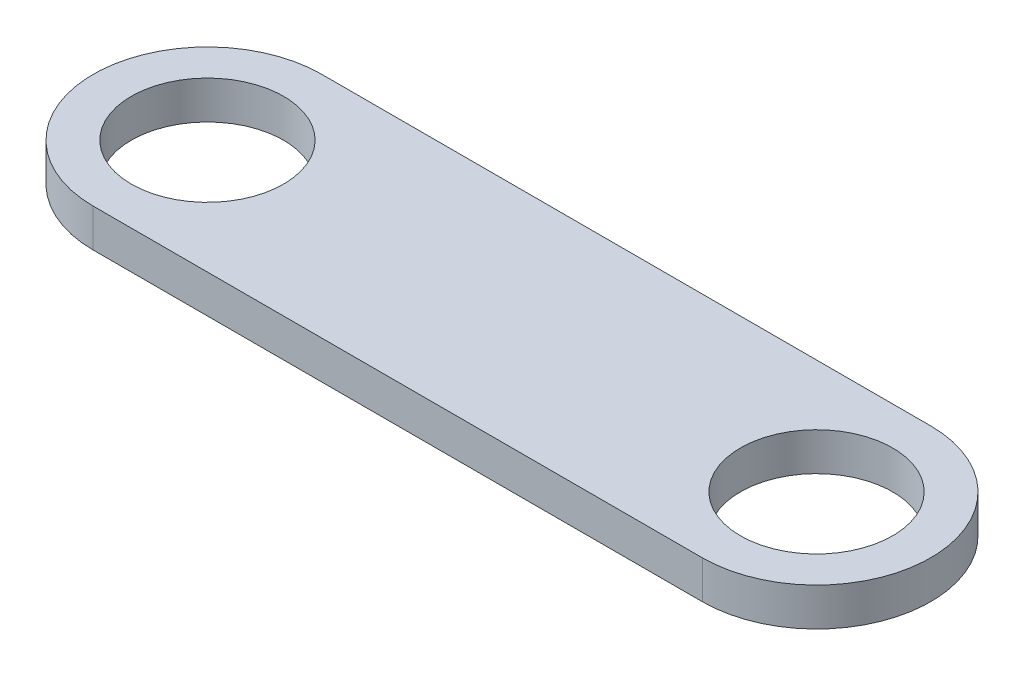
from build123d import *

# Parameters (mm, degrees)
SKETCH2_R           = 6.35
BOSS_EXTRUDE1_DEPTH = 3.175


with BuildPart() as part:
    # Sketch2 → Boss-Extrude1 (new body)
    with BuildSketch(Plane(origin=(0, 0, 0), x_dir=(1, 0, 0), z_dir=(0, 1, 0))):
        with BuildLine():
            Line((0, 9.525), (50.8, 9.525))
            ThreePointArc((50.8, 9.525), (60.325, 0), (50.8, -9.525))
            Line((50.8, -9.525), (0, -9.525))
            ThreePointArc((0, -9.525), (-9.525, 0), (0, 9.525))
        make_face()
        with Locations(Location((0, 0, 0), (0, 0, 270))):
            Circle(SKETCH2_R, mode=Mode.SUBTRACT)
        with Locations(Location((50.8, 0, 0), (0, 0, 270))):
            Circle(SKETCH2_R, mode=Mode.SUBTRACT)
    extrude(amount=BOSS_EXTRUDE1_DEPTH)


solid = part.part
